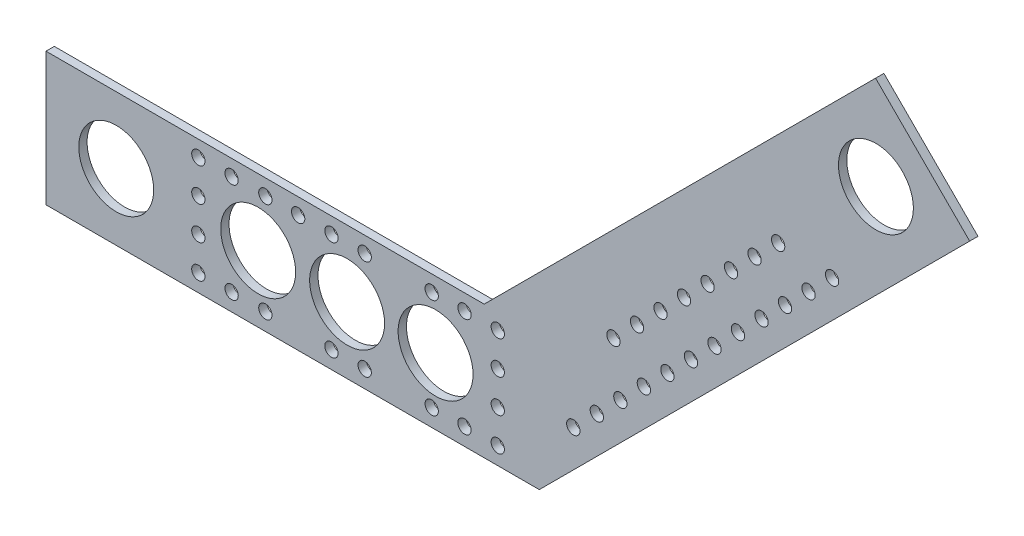
from build123d import *

# Parameters (mm, degrees)
SKETCH1_R           = 2.54
SKETCH1_R_2         = 14.3002
BOSS_EXTRUDE1_DEPTH = 3.175


with BuildPart() as part:
    # Sketch1 → Boss-Extrude1 (new body)
    with BuildSketch(Plane.XY):
        Polygon((-59.693768546, 4.271271353), (-59.693768546, -46.528728647), (128.614138554, -46.528728647), (292.911431822, 117.768564621), (256.990407338, 153.689589105), (107.572089586, 4.271271353), align=None)
        with Locations((141.594566523, -19.421025607)):
            Circle(SKETCH1_R, mode=Mode.SUBTRACT)
        with Locations((150.574822644, -10.440769486)):
            Circle(SKETCH1_R, mode=Mode.SUBTRACT)
        with Locations((159.555078765, -1.460513365)):
            Circle(SKETCH1_R, mode=Mode.SUBTRACT)
        with Locations((168.535334886, 7.519742756)):
            Circle(SKETCH1_R, mode=Mode.SUBTRACT)
        with Locations((177.515591007, 16.499998877)):
            Circle(SKETCH1_R, mode=Mode.SUBTRACT)
        with Locations((186.495847129, 25.480254999)):
            Circle(SKETCH1_R, mode=Mode.SUBTRACT)
        with Locations((195.47610325, 34.46051112)):
            Circle(SKETCH1_R, mode=Mode.SUBTRACT)
        with Locations((204.456359371, 43.440767241)):
            Circle(SKETCH1_R, mode=Mode.SUBTRACT)
        with Locations((213.436615492, 52.421023362)):
            Circle(SKETCH1_R, mode=Mode.SUBTRACT)
        with Locations((222.416871613, 61.401279483)):
            Circle(SKETCH1_R, mode=Mode.SUBTRACT)
        with Locations((231.397127734, 70.381535604)):
            Circle(SKETCH1_R, mode=Mode.SUBTRACT)
        with Locations((240.377383855, 79.361791725)):
            Circle(SKETCH1_R, mode=Mode.SUBTRACT)
        with Locations((11.158871814, -1.812116048)):
            Circle(SKETCH1_R, mode=Mode.SUBTRACT)
        with Locations((24.040159799, -1.812116048)):
            Circle(SKETCH1_R, mode=Mode.SUBTRACT)
        with Locations((36.558871814, -1.812116048)):
            Circle(SKETCH1_R, mode=Mode.SUBTRACT)
        with Locations((49.258871814, -1.812116048)):
            Circle(SKETCH1_R, mode=Mode.SUBTRACT)
        with Locations((61.958871814, -1.812116048)):
            Circle(SKETCH1_R, mode=Mode.SUBTRACT)
        with Locations((87.540159799, -1.812116048)):
            Circle(SKETCH1_R, mode=Mode.SUBTRACT)
        with Locations((100.058871814, -1.812116048)):
            Circle(SKETCH1_R, mode=Mode.SUBTRACT)
        with Locations((112.758871814, -1.812116048)):
            Circle(SKETCH1_R, mode=Mode.SUBTRACT)
        with Locations((112.758871814, -14.512116048)):
            Circle(SKETCH1_R, mode=Mode.SUBTRACT)
        with Locations((112.758871814, -27.212116048)):
            Circle(SKETCH1_R, mode=Mode.SUBTRACT)
        with Locations((112.758871814, -39.912116048)):
            Circle(SKETCH1_R, mode=Mode.SUBTRACT)
        with Locations((100.058871814, -39.912116048)):
            Circle(SKETCH1_R, mode=Mode.SUBTRACT)
        with Locations((87.540159799, -39.912116048)):
            Circle(SKETCH1_R, mode=Mode.SUBTRACT)
        with Locations((61.958871814, -39.912116048)):
            Circle(SKETCH1_R, mode=Mode.SUBTRACT)
        with Locations((49.258871814, -39.912116048)):
            Circle(SKETCH1_R, mode=Mode.SUBTRACT)
        with Locations((24.040159799, -39.912116048)):
            Circle(SKETCH1_R, mode=Mode.SUBTRACT)
        with Locations((11.158871814, -39.912116048)):
            Circle(SKETCH1_R, mode=Mode.SUBTRACT)
        with Locations((-1.541128186, -39.912116048)):
            Circle(SKETCH1_R, mode=Mode.SUBTRACT)
        with Locations((-1.541128186, -27.212116048)):
            Circle(SKETCH1_R, mode=Mode.SUBTRACT)
        with Locations((-1.541128186, -14.512116048)):
            Circle(SKETCH1_R, mode=Mode.SUBTRACT)
        with Locations((-1.541128186, -1.812116048)):
            Circle(SKETCH1_R, mode=Mode.SUBTRACT)
        with Locations((55.2538213, -21.128728647)):
            Circle(SKETCH1_R_2, mode=Mode.SUBTRACT)
        with Locations((-32.8841787, -21.128728647)):
            Circle(SKETCH1_R_2, mode=Mode.SUBTRACT)
        with Locations((257.120708411, 117.898865694)):
            Circle(SKETCH1_R_2, mode=Mode.SUBTRACT)
        with Locations((21.301280743, -21.128728647)):
            Circle(SKETCH1_R_2, mode=Mode.SUBTRACT)
        with Locations((89.0240103, -21.128728647)):
            Circle(SKETCH1_R_2, mode=Mode.SUBTRACT)
        with Locations((156.927029711, 17.705186994)):
            Circle(SKETCH1_R, mode=Mode.SUBTRACT)
        with Locations((165.907285832, 26.685443115)):
            Circle(SKETCH1_R, mode=Mode.SUBTRACT)
        with Locations((174.887541953, 35.665699236)):
            Circle(SKETCH1_R, mode=Mode.SUBTRACT)
        with Locations((183.867798074, 44.645955357)):
            Circle(SKETCH1_R, mode=Mode.SUBTRACT)
        with Locations((192.848054195, 53.626211478)):
            Circle(SKETCH1_R, mode=Mode.SUBTRACT)
        with Locations((201.828310316, 62.606467599)):
            Circle(SKETCH1_R, mode=Mode.SUBTRACT)
        with Locations((210.808566437, 71.58672372)):
            Circle(SKETCH1_R, mode=Mode.SUBTRACT)
        with Locations((219.788822558, 80.566979841)):
            Circle(SKETCH1_R, mode=Mode.SUBTRACT)
    extrude(amount=BOSS_EXTRUDE1_DEPTH)


solid = part.part
